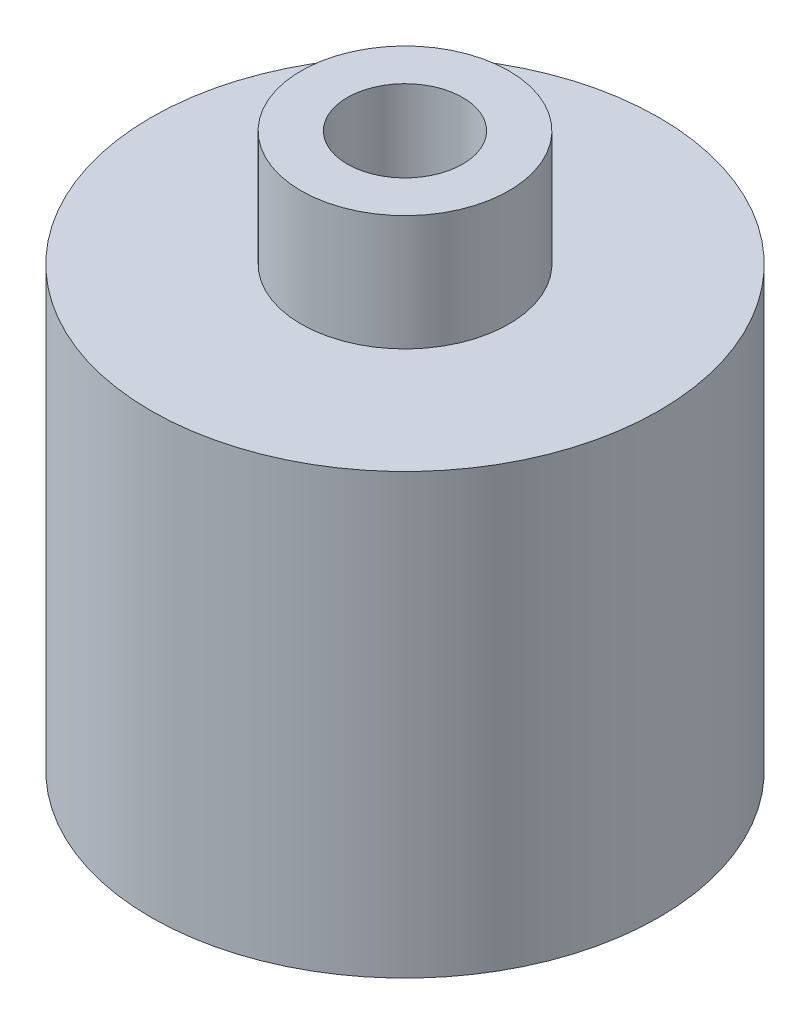
from build123d import *

# Parameters (mm, degrees)
SKETCH1_R           = 11
SKETCH1_R_2         = 2.5
BOSS_EXTRUDE1_DEPTH = 19
SKETCH2_R           = 4.5
SKETCH2_R_2         = 2.5
BOSS_EXTRUDE4_DEPTH = 5


with BuildPart() as part:
    # Sketch1 → Boss-Extrude1 (new body)
    with BuildSketch(Plane(origin=(0, 0, 0), x_dir=(1, 0, 0), z_dir=(0, 1, 0))):
        with Locations(Location((0, 0, 0), (0, 0, 270))):
            Circle(SKETCH1_R)
        with Locations(Location((0, 0, 0), (0, 0, 270))):
            Circle(SKETCH1_R_2, mode=Mode.SUBTRACT)
    extrude(amount=BOSS_EXTRUDE1_DEPTH)

    # Sketch2 → Boss-Extrude4 (add)
    with BuildSketch(Plane(origin=(0, 19, 0), x_dir=(1, 0, 0), z_dir=(0, 1, 0))):
        with Locations(Location((0, 0, 0), (0, 0, 270))):
            Circle(SKETCH2_R)
        with Locations(Location((0, 0, 0), (0, 0, 270))):
            Circle(SKETCH2_R_2, mode=Mode.SUBTRACT)
    extrude(amount=BOSS_EXTRUDE4_DEPTH)


solid = part.part
